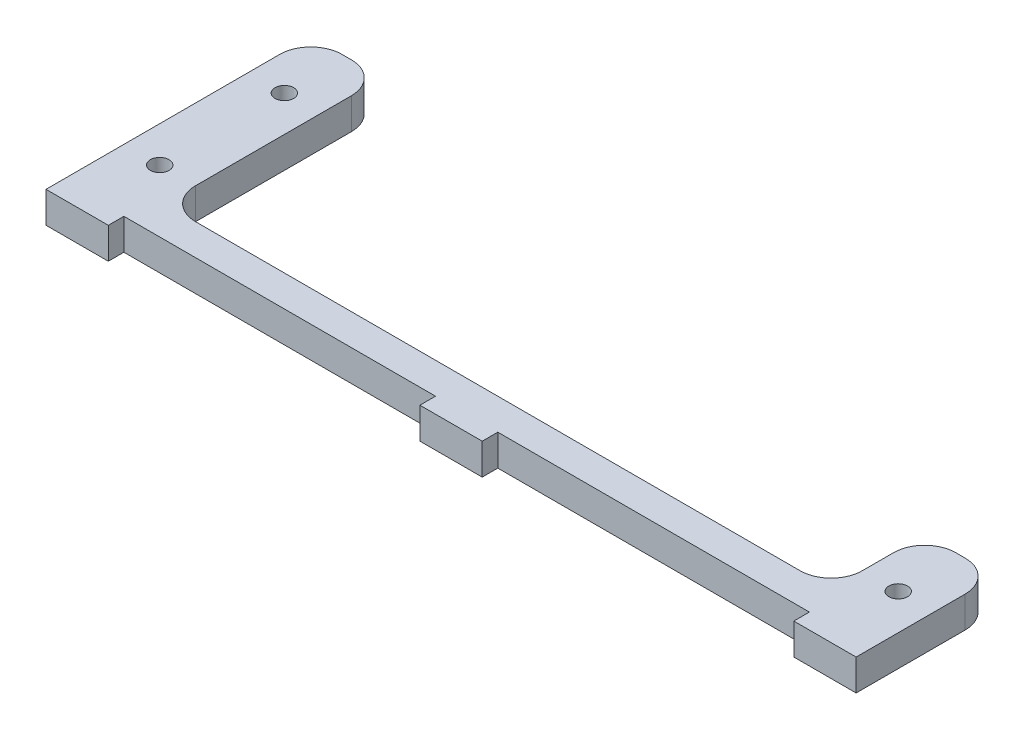
from build123d import *

# Parameters (mm, degrees)
SKETCH1_R           = 1.905
BOSS_EXTRUDE1_DEPTH = 6.35


with BuildPart() as part:
    # Sketch1 → Boss-Extrude1 (new body)
    with BuildSketch(Plane(origin=(0, 0, 0), x_dir=(1, 0, 0), z_dir=(0, 1, 0))):
        with BuildLine():
            Line((88.9, -6.35), (152.4, -6.35))
            Line((152.4, -6.35), (152.4, -9.525))
            Line((152.4, -9.525), (165.1, -9.525))
            Line((165.1, -9.525), (165.1, -6.35))
            Line((165.1, -6.35), (165.1, 0))
            Line((165.1, 0), (165.1, 12.7))
            ThreePointArc((165.1, 12.7), (163.240128061, 17.190128061), (158.75, 19.05))
            Line((158.75, 19.05), (156.845, 19.05))
            ThreePointArc((156.845, 19.05), (152.354871939, 17.190128061), (150.495, 12.7))
            Line((150.495, 12.7), (150.495, 6.35))
            ThreePointArc((150.495, 6.35), (148.635128061, 1.859871939), (144.145, 0))
            Line((144.145, 0), (20.955, 0))
            ThreePointArc((20.955, 0), (16.464871939, 1.859871939), (14.605, 6.35))
            Line((14.605, 6.35), (14.605, 38.1))
            ThreePointArc((14.605, 38.1), (12.745128061, 42.590128061), (8.255, 44.45))
            Line((8.255, 44.45), (6.35, 44.45))
            ThreePointArc((6.35, 44.45), (1.859871939, 42.590128061), (0, 38.1))
            Line((0, 38.1), (0, 0))
            Line((0, 0), (0, -6.35))
            Line((0, -6.35), (0, -9.525))
            Line((0, -9.525), (12.7, -9.525))
            Line((12.7, -9.525), (12.7, -6.35))
            Line((12.7, -6.35), (76.2, -6.35))
            Line((76.2, -6.35), (76.2, -9.525))
            Line((76.2, -9.525), (88.9, -9.525))
            Line((88.9, -9.525), (88.9, -6.35))
        make_face()
        with Locations(Location((7.3025, 31.75, 0), (0, 0, 270))):
            Circle(SKETCH1_R, mode=Mode.SUBTRACT)
        with Locations(Location((7.3025, 6.35, 0), (0, 0, 270))):
            Circle(SKETCH1_R, mode=Mode.SUBTRACT)
        with Locations(Location((157.7975, 6.353059153, 0), (0, 0, 270))):
            Circle(SKETCH1_R, mode=Mode.SUBTRACT)
    extrude(amount=BOSS_EXTRUDE1_DEPTH)


solid = part.part
